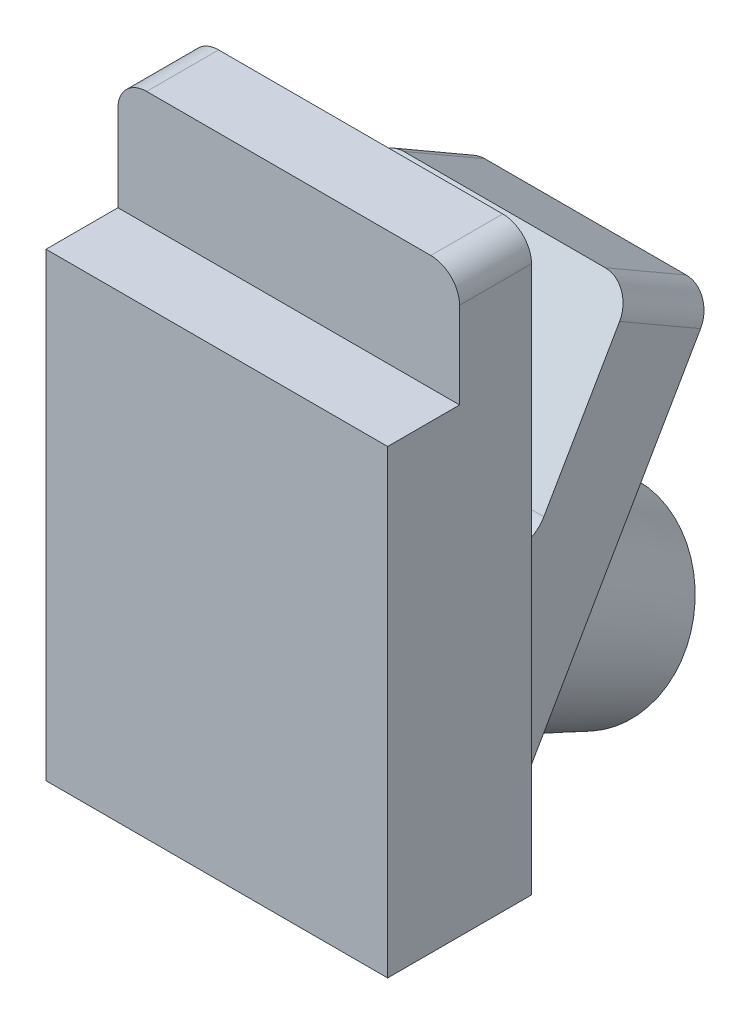
from build123d import *

# Parameters (mm, degrees)
SKETCH1_W           = 23.75
SKETCH1_H           = 40
BOSS_EXTRUDE1_DEPTH = 10
SKETCH2_W           = 23.75
SKETCH2_H           = 8
CUT_EXTRUDE1_DEPTH  = 5
FILLET1_R           = 2
BOSS_EXTRUDE3_REACH = 44.573
SKETCH6_W           = 18
SKETCH6_H           = 6.5
SKETCH7_W           = 18
SKETCH7_H           = 6.5
CUT_EXTRUDE2_DEPTH  = 3.38
FILLET4_R           = 2
SKETCH8_R           = 7.5
BOSS_EXTRUDE4_DEPTH = 12
BOSS_EXTRUDE4_TAPER = 5
SKETCH9_R           = 5
CUT_EXTRUDE4_DEPTH  = 12
SKETCH10_R          = 5
CUT_EXTRUDE5_DEPTH  = 12
CUT_EXTRUDE5_DRAFT  = -5


with BuildPart() as part:
    # Sketch1 → Boss-Extrude1 (new body)
    with BuildSketch(Plane.XY):
        Rectangle(SKETCH1_W, SKETCH1_H)
    extrude(amount=-BOSS_EXTRUDE1_DEPTH)

    # Sketch2 → Cut-Extrude1 (cut)
    with BuildSketch(Plane.XY):
        with Locations((0, 16)):
            Rectangle(SKETCH2_W, SKETCH2_H)
    extrude(amount=-CUT_EXTRUDE1_DEPTH, mode=Mode.SUBTRACT)

    # Fillet1
    fillet1_edges = [part.edges().sort_by_distance(p)[0] for p in [
        (-11.875, 20, -7.5),
        (11.875, 20, -7.5),
    ]]
    fillet(fillet1_edges, radius=FILLET1_R)

    # Boss-Extrude3: up to this plane
    boss_extrude3_end = Plane(origin=(0, 0, -10), z_dir=(0, 0, -1))
    # Sketch6 → Boss-Extrude3 (add, up to the surface)
    with BuildSketch(Plane(origin=(0, 19.330127019, -11.160254038), x_dir=(-1, 0, 0), z_dir=(0, -0.866025403784438, 0.500000000000001)), mode=Mode.PRIVATE) as boss_extrude3_sk1:
        with Locations((0, 15.410254038)):
            Rectangle(SKETCH6_W, SKETCH6_H)
    boss_extrude3_tool1 = split(extrude(boss_extrude3_sk1.sketch, amount=BOSS_EXTRUDE3_REACH, mode=Mode.PRIVATE), bisect_by=boss_extrude3_end, keep=Keep.BOTH, mode=Mode.PRIVATE)
    add(boss_extrude3_tool1.solids().sort_by_distance((0, 11.625, -24.505926))[0])

    # Sketch7 → Cut-Extrude2 (cut)
    with BuildSketch(Plane(origin=(0, 19.330127019, -11.160254038), x_dir=(1, 0, 0), z_dir=(0, 0.866025403784438, -0.5000000000000012))):
        with Locations((0, 15.410254038)):
            Rectangle(SKETCH7_W, SKETCH7_H)
    extrude(amount=-CUT_EXTRUDE2_DEPTH, mode=Mode.SUBTRACT)

    # Fillet4
    fillet4_edges = [part.edges().sort_by_distance(p)[0] for p in [
        (0, -7, -10),
        (9, 8.697834135, -22.815925513),
        (-9, 8.697834135, -22.815925513),
    ]]
    fillet(fillet4_edges, radius=FILLET4_R)

    # Sketch8 → Boss-Extrude4 (add)
    with BuildSketch(Plane(origin=(0, -9.330127019, -16.160254038), x_dir=(-1, 0, 0), z_dir=(0, -0.500000000000001, -0.8660254037844382))):
        with Locations((0, -1.020508076)):
            Circle(SKETCH8_R)
    extrude(amount=BOSS_EXTRUDE4_DEPTH, taper=BOSS_EXTRUDE4_TAPER)

    # Sketch9 → Cut-Extrude4 (cut)
    with BuildSketch(Plane(origin=(0, -15.330127019, -26.552558883), x_dir=(-1, 0, 0), z_dir=(0, -0.5000000000000011, -0.8660254037844382))):
        with Locations(Location((0, -1.020508076, 0), (0, 0, 90))):
            Circle(SKETCH9_R)
    extrude(amount=-CUT_EXTRUDE4_DEPTH, mode=Mode.SUBTRACT)


with BuildPart() as cut_extrude5_tool:
    # Sketch10 → Cut-Extrude5 (with draft: the straight prism first)
    with BuildSketch(Plane(origin=(0, -9.330127019, -16.160254038), x_dir=(-1, 0, 0), z_dir=(0, -0.5000000000000012, -0.866025403784438))):
        with Locations((0, -1.020508076)):
            Circle(SKETCH10_R)
    extrude(amount=CUT_EXTRUDE5_DEPTH)
    # Cut-Extrude5: the draft: its side faces are tilted about the plane it starts from
    cut_extrude5_sides = [cut_extrude5_tool.faces().sort_by_distance(p)[0] for p in [
        (5, -13.213912937, -20.846152423),
    ]]
    draft(cut_extrude5_sides, Plane(origin=(0, -9.330127019, -16.160254038), x_dir=(-1, 0, 0), z_dir=(0, -0.5000000000000012, -0.866025403784438)), CUT_EXTRUDE5_DRAFT)


with BuildPart() as part_1:
    add(part.part)

    # Cut-Extrude5: cut by cut_extrude5_tool
    add(cut_extrude5_tool.part, mode=Mode.SUBTRACT)


solid = part_1.part
